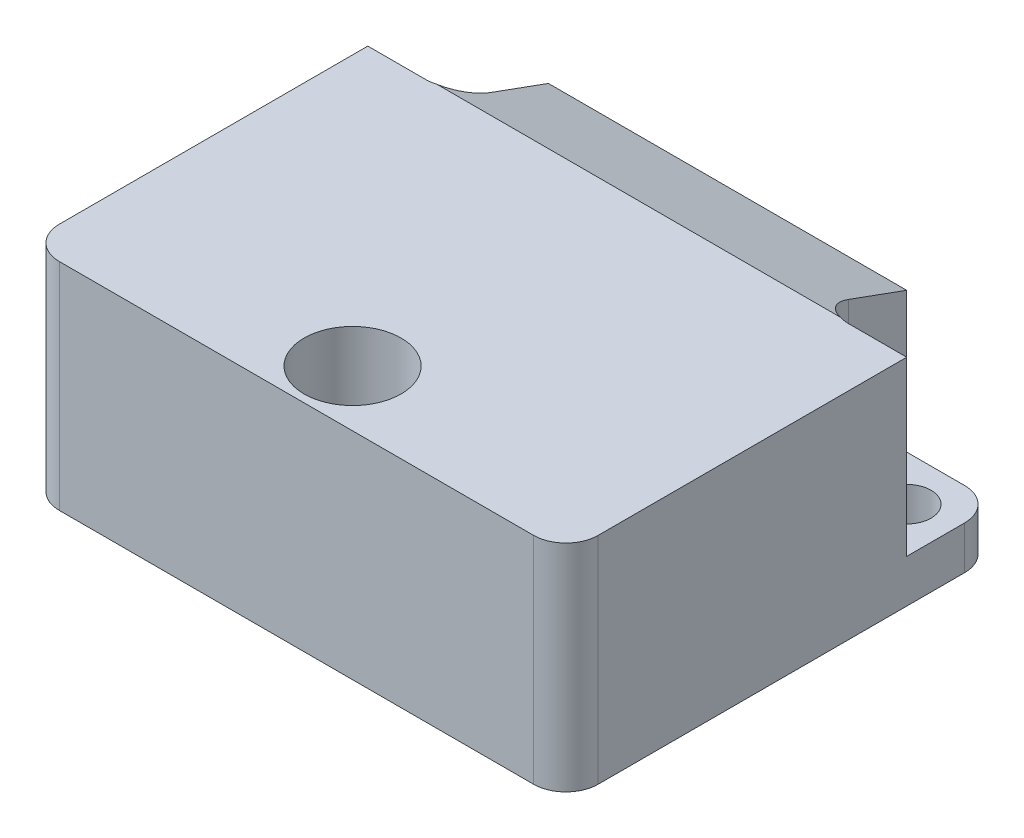
from build123d import *

# Parameters (mm, degrees)
SKETCH1_W           = 50
SKETCH1_H           = 40
BOSS_EXTRUDE1_DEPTH = 20
FILLET1_R           = 3
SKETCH2_W           = 15
SKETCH2_H           = 15
CUT_EXTRUDE1_DEPTH  = 16
SKETCH3_R           = 2.252565919
CUT_EXTRUDE2_DEPTH  = 16
FILLET2_R           = 3
CHAMFER1_SIZE       = 3
CHAMFER1_SIZE2      = 8.242432258
SKETCH4_R           = 4.5
CUT_EXTRUDE3_DEPTH  = 38.749172176
CUT_EXTRUDE4_DEPTH  = 5
SKETCH6_R           = 1.794410379
CUT_EXTRUDE5_DEPTH  = 8
SKETCH7_R           = 0.310906048
BOSS_EXTRUDE2_DEPTH = 4.5


with BuildPart() as part:
    # Sketch1 → Boss-Extrude1 (new body)
    with BuildSketch(Plane(origin=(0, 0, 0), x_dir=(1, 0, 0), z_dir=(0, 1, 0))):
        Rectangle(SKETCH1_W, SKETCH1_H)
    extrude(amount=BOSS_EXTRUDE1_DEPTH)

    # Fillet1
    fillet1_edges = [part.edges().sort_by_distance(p)[0] for p in [
        (25, 10, 20),
        (-25, 10, 20),
        (-25, 10, -20),
        (25, 10, -20),
    ]]
    fillet(fillet1_edges, radius=FILLET1_R)

    # Sketch2 → Cut-Extrude1 (cut)
    with BuildSketch(Plane(origin=(0, 20, 0), x_dir=(1, 0, 0), z_dir=(0, 1, 0))):
        with Locations((-24.121320344, 19.121320344)):
            Rectangle(SKETCH2_W, SKETCH2_H)
        with Locations((24.121320344, 19.121320344)):
            Rectangle(SKETCH2_W, SKETCH2_H)
    extrude(amount=-CUT_EXTRUDE1_DEPTH, mode=Mode.SUBTRACT)

    # Sketch3 → Cut-Extrude2 (cut)
    with BuildSketch(Plane(origin=(0, 4, 0), x_dir=(1, 0, 0), z_dir=(0, 1, 0))):
        with Locations(Location((20.810660172, 15.810660172, 0), (0, 0, 270))):
            Circle(SKETCH3_R)
        with Locations(Location((-20.810660172, 15.810660172, 0), (0, 0, 90))):
            Circle(SKETCH3_R)
    extrude(amount=-CUT_EXTRUDE2_DEPTH, mode=Mode.SUBTRACT)

    # Fillet2
    fillet2_edges = [part.edges().sort_by_distance(p)[0] for p in [
        (-16.621320344, 12, -11.621320344),
        (16.621320344, 12, -11.621320344),
    ]]
    fillet(fillet2_edges, radius=FILLET2_R)

    # Chamfer1
    chamfer1_edges = [part.edges().sort_by_distance(p)[0] for p in [
        (0, 20, -20),
    ]]
    chamfer1_side = [part.faces().sort_by_distance(p)[0] for p in [
        (0, 9.513710794, -20),
    ]]
    chamfer(chamfer1_edges, length=CHAMFER1_SIZE, length2=CHAMFER1_SIZE2, reference=chamfer1_side[0])

    # Sketch4 → Cut-Extrude3 (cut, through all)
    with BuildSketch(Plane(origin=(0, 20, 0), x_dir=(1, 0, 0), z_dir=(0, 1, 0))):
        with Locations(Location((0, -14.79019389, 0), (0, 0, 270))):
            Circle(SKETCH4_R)
    extrude(amount=-CUT_EXTRUDE3_DEPTH, mode=Mode.SUBTRACT)

    # Sketch5 → Cut-Extrude4 (cut)
    with BuildSketch(Plane(origin=(0, 0, -20), x_dir=(-1, 0, 0), z_dir=(0, 0, -1))):
        Polygon((6.87465001, 10.97114015), (-6.87465001, 10.97114015), (-8.382472875, 9.463317285), (-7.628561442, 8.709405853), (7.628561442, 8.709405853), (8.382472875, 9.463317285), align=None)
    extrude(amount=-CUT_EXTRUDE4_DEPTH, mode=Mode.SUBTRACT)

    # Sketch6 → Cut-Extrude5 (cut)
    with BuildSketch(Plane(origin=(0, 0, -20), x_dir=(-1, 0, 0), z_dir=(0, 0, -1))):
        with Locations((13.008166747, 10.460013755)):
            Circle(SKETCH6_R)
        with Locations(Location((-13.008166747, 10.460013755, 0), (0, 0, 180))):
            Circle(SKETCH6_R)
    extrude(amount=-CUT_EXTRUDE5_DEPTH, mode=Mode.SUBTRACT)

    # Sketch7 → Boss-Extrude2 (add)
    with BuildSketch(Plane(origin=(0, 0, -15), x_dir=(-1, 0, 0), z_dir=(0, 0, -1))):
        with Locations(Location((0, 10.357788476, 0), (0, 0, 180))):
            Circle(SKETCH7_R)
        with Locations(Location((1, 10.357788476, 0), (0, 0, 180))):
            Circle(SKETCH7_R)
        with Locations(Location((2, 10.357788476, 0), (0, 0, 180))):
            Circle(SKETCH7_R)
        with Locations(Location((3, 10.357788476, 0), (0, 0, 180))):
            Circle(SKETCH7_R)
        with Locations(Location((4, 10.357788476, 0), (0, 0, 180))):
            Circle(SKETCH7_R)
        with Locations(Location((5, 10.357788476, 0), (0, 0, 180))):
            Circle(SKETCH7_R)
        with Locations(Location((6, 10.357788476, 0), (0, 0, 180))):
            Circle(SKETCH7_R)
        with Locations(Location((1, 9.357788476, 0), (0, 0, 180))):
            Circle(SKETCH7_R)
        with Locations(Location((2, 9.357788476, 0), (0, 0, 180))):
            Circle(SKETCH7_R)
        with Locations(Location((3, 9.357788476, 0), (0, 0, 180))):
            Circle(SKETCH7_R)
        with Locations(Location((4, 9.357788476, 0), (0, 0, 180))):
            Circle(SKETCH7_R)
        with Locations(Location((5, 9.357788476, 0), (0, 0, 180))):
            Circle(SKETCH7_R)
        with Locations(Location((6, 9.357788476, 0), (0, 0, 180))):
            Circle(SKETCH7_R)
        with Locations(Location((0, 9.357788476, 0), (0, 0, 180))):
            Circle(SKETCH7_R)
        with Locations(Location((-6, 9.357788476, 0), (0, 0, 180))):
            Circle(SKETCH7_R)
        with Locations(Location((-5, 9.357788476, 0), (0, 0, 180))):
            Circle(SKETCH7_R)
        with Locations(Location((-4, 9.357788476, 0), (0, 0, 180))):
            Circle(SKETCH7_R)
        with Locations(Location((-3, 9.357788476, 0), (0, 0, 180))):
            Circle(SKETCH7_R)
        with Locations(Location((-2, 9.357788476, 0), (0, 0, 180))):
            Circle(SKETCH7_R)
        with Locations(Location((-1, 9.357788476, 0), (0, 0, 180))):
            Circle(SKETCH7_R)
        with Locations(Location((-6, 10.357788476, 0), (0, 0, 180))):
            Circle(SKETCH7_R)
        with Locations(Location((-5, 10.357788476, 0), (0, 0, 180))):
            Circle(SKETCH7_R)
        with Locations(Location((-4, 10.357788476, 0), (0, 0, 180))):
            Circle(SKETCH7_R)
        with Locations(Location((-3, 10.357788476, 0), (0, 0, 180))):
            Circle(SKETCH7_R)
        with Locations(Location((-2, 10.357788476, 0), (0, 0, 180))):
            Circle(SKETCH7_R)
        with Locations(Location((-1, 10.357788476, 0), (0, 0, 180))):
            Circle(SKETCH7_R)
    extrude(amount=BOSS_EXTRUDE2_DEPTH)


solid = part.part
